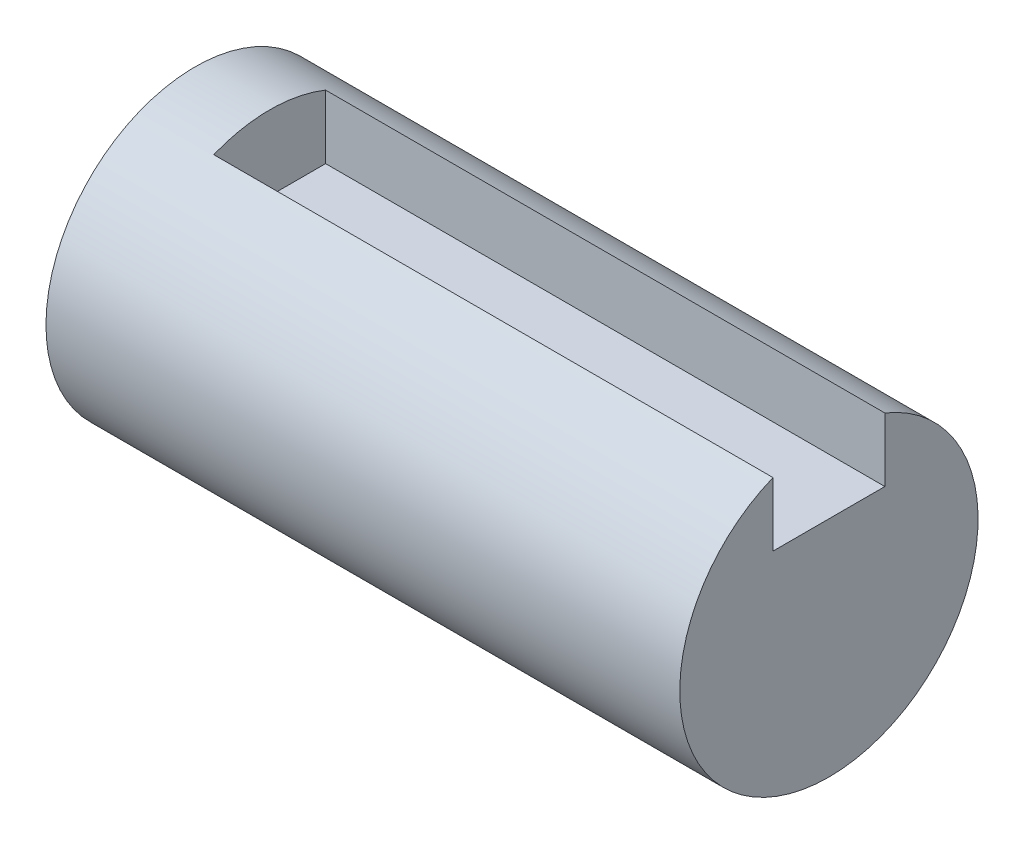
from build123d import *

# Parameters (mm, degrees)
SKETCH_1_R          = 4
EXTRUDE_1_DEPTH     = 17
CUT_EXTRUDE_1_DEPTH = 15


with BuildPart() as part:
    # 草图1 → 凸台-拉伸1 (new body)
    with BuildSketch(Plane(origin=(0, 0, 0), x_dir=(0, 0, -1), z_dir=(1, 0, 0))):
        Circle(SKETCH_1_R)
    extrude(amount=EXTRUDE_1_DEPTH)

    # 草图2 → 切除-拉伸1 (cut)
    with BuildSketch(Plane(origin=(17, 0, 0), x_dir=(0, 0, -1), z_dir=(1, 0, 0))):
        Polygon((-1.5, 32.646398423), (-1.5, 3.708099244), (-1.5, 2), (1.5, 2), (1.5, 3.708099244), (1.5, 32.646398423), (1.5, 90.522996781), (-1.5, 90.522996781), align=None)
    extrude(amount=-CUT_EXTRUDE_1_DEPTH, mode=Mode.SUBTRACT)


solid = part.part
